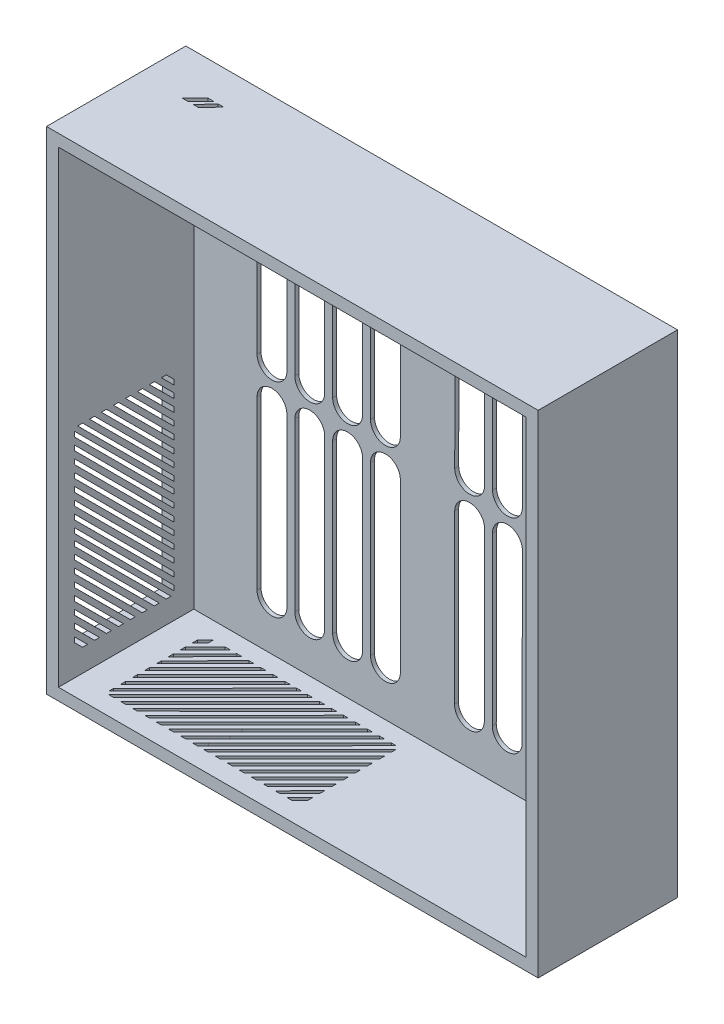
from build123d import *

# Parameters (mm, degrees)
ESBO_O1_W                = 247
ESBO_O1_H                = 247
RESSALTO_EXTRUS_O1_DEPTH = 70
ESBO_O2_W                = 235
ESBO_O2_H                = 235
CORTE_EXTRUS_O1_DEPTH    = 68
CORTE_EXTRUS_O2_DEPTH    = 338.361039757
CORTE_EXTRUS_O4_DEPTH    = 13
ESBO_O12_R               = 13.5
CORTE_EXTRUS_O7_DEPTH    = 10
CORTE_EXTRUS_O8_DEPTH    = 2


with BuildPart() as part:
    # Esboço1 → Ressalto-extrusão1 (new body)
    with BuildSketch(Plane.XY):
        with Locations((106.930425713, 113.333887043)):
            Rectangle(ESBO_O1_W, ESBO_O1_H)
    extrude(amount=RESSALTO_EXTRUS_O1_DEPTH)

    # Esboço2 → Corte-extrusão1 (cut)
    with BuildSketch(Plane.XY.offset(70)):
        with Locations((106.930425713, 113.333887043)):
            Rectangle(ESBO_O2_W, ESBO_O2_H)
    extrude(amount=-CORTE_EXTRUS_O1_DEPTH, mode=Mode.SUBTRACT)

    # Esboço6 → Corte-extrusão2 (cut, through all)
    with BuildSketch(Plane.XY.offset(2)):
        with BuildLine():
            Line((21.196532394, 206.667609314), (21.196532394, 122.653986802))
            ThreePointArc((21.196532394, 122.653986802), (28.696532394, 115.153986802), (36.196532394, 122.653986802))
            Line((36.196532394, 122.653986802), (36.196532394, 206.667609314))
            ThreePointArc((36.196532394, 206.667609314), (28.696532394, 214.167609314), (21.196532394, 206.667609314))
        make_face()
        with BuildLine():
            Line((40.196532394, 206.667609314), (40.196532394, 122.653986802))
            ThreePointArc((40.196532394, 122.653986802), (47.696532394, 115.153986802), (55.196532394, 122.653986802))
            Line((55.196532394, 122.653986802), (55.196532394, 206.667609314))
            ThreePointArc((55.196532394, 206.667609314), (47.696532394, 214.167609314), (40.196532394, 206.667609314))
        make_face()
        with BuildLine():
            Line((59.196532394, 206.667609314), (59.196532394, 122.653986802))
            ThreePointArc((59.196532394, 122.653986802), (66.696532394, 115.153986802), (74.196532394, 122.653986802))
            Line((74.196532394, 122.653986802), (74.196532394, 206.667609314))
            ThreePointArc((74.196532394, 206.667609314), (66.696532394, 214.167609314), (59.196532394, 206.667609314))
        make_face()
        with BuildLine():
            Line((78.196532394, 206.667609314), (78.196532394, 122.653986802))
            ThreePointArc((78.196532394, 122.653986802), (85.696532394, 115.153986802), (93.196532394, 122.653986802))
            Line((93.196532394, 122.653986802), (93.196532394, 206.667609314))
            ThreePointArc((93.196532394, 206.667609314), (85.696532394, 214.167609314), (78.196532394, 206.667609314))
        make_face()
        with BuildLine():
            Line((93.196532394, 104.013787284), (93.196532394, 20.000164773))
            ThreePointArc((93.196532394, 20.000164773), (85.696532394, 12.500164773), (78.196532394, 20.000164773))
            Line((78.196532394, 20.000164773), (78.196532394, 104.013787284))
            ThreePointArc((78.196532394, 104.013787284), (85.696532394, 111.513787284), (93.196532394, 104.013787284))
        make_face()
        with BuildLine():
            Line((74.196532394, 104.013787284), (74.196532394, 20.000164773))
            ThreePointArc((74.196532394, 20.000164773), (66.696532394, 12.500164773), (59.196532394, 20.000164773))
            Line((59.196532394, 20.000164773), (59.196532394, 104.013787284))
            ThreePointArc((59.196532394, 104.013787284), (66.696532394, 111.513787284), (74.196532394, 104.013787284))
        make_face()
        with BuildLine():
            Line((55.196532394, 104.013787284), (55.196532394, 20.000164773))
            ThreePointArc((55.196532394, 20.000164773), (47.696532394, 12.500164773), (40.196532394, 20.000164773))
            Line((40.196532394, 20.000164773), (40.196532394, 104.013787284))
            ThreePointArc((40.196532394, 104.013787284), (47.696532394, 111.513787284), (55.196532394, 104.013787284))
        make_face()
        with BuildLine():
            Line((36.196532394, 20.000164773), (36.196532394, 104.013787284))
            ThreePointArc((36.196532394, 104.013787284), (28.696532394, 111.513787284), (21.196532394, 104.013787284))
            Line((21.196532394, 104.013787284), (21.196532394, 20.000164773))
            ThreePointArc((21.196532394, 20.000164773), (28.696532394, 12.500164773), (36.196532394, 20.000164773))
        make_face()
        with BuildLine():
            Line((192.376128957, 19.883203927), (192.490935861, 103.896747995))
            ThreePointArc((192.490935861, 103.896747995), (185.001191818, 111.406989947), (177.490949866, 103.917245904))
            Line((177.490949866, 103.917245904), (177.376142963, 19.903701836))
            ThreePointArc((177.376142963, 19.903701836), (184.865887006, 12.393459884), (192.376128957, 19.883203927))
        make_face()
        with BuildLine():
            Line((173.376146697, 19.909167945), (173.490953601, 103.922712013))
            ThreePointArc((173.490953601, 103.922712013), (166.001209558, 111.432953964), (158.490967607, 103.943209921))
            Line((158.490967607, 103.943209921), (158.376160703, 19.929665853))
            ThreePointArc((158.376160703, 19.929665853), (165.865904746, 12.419423902), (173.376146697, 19.909167945))
        make_face()
        with BuildLine():
            Line((154.376164438, 19.935131962), (154.490971341, 103.94867603))
            ThreePointArc((154.490971341, 103.94867603), (147.001227299, 111.458917982), (139.490985347, 103.969173939))
            Line((139.490985347, 103.969173939), (139.376178443, 19.955629871))
            ThreePointArc((139.376178443, 19.955629871), (146.865922486, 12.445387919), (154.376164438, 19.935131962))
        make_face()
        with BuildLine():
            Line((135.376182178, 19.96109598), (135.490989082, 103.974640048))
            ThreePointArc((135.490989082, 103.974640048), (128.001245039, 111.484881999), (120.491003087, 103.995137956))
            Line((120.491003087, 103.995137956), (120.376196184, 19.981593889))
            ThreePointArc((120.376196184, 19.981593889), (127.865940226, 12.471351937), (135.376182178, 19.96109598))
        make_face()
        with BuildLine():
            Line((120.516475428, 122.63532007), (120.631282331, 206.648864138))
            ThreePointArc((120.631282331, 206.648864138), (128.141524283, 214.138608181), (135.631268326, 206.62836623))
            Line((135.631268326, 206.62836623), (135.516461422, 122.614822162))
            ThreePointArc((135.516461422, 122.614822162), (128.006219471, 115.125078119), (120.516475428, 122.63532007))
        make_face()
        with BuildLine():
            Line((139.516457687, 122.609356053), (139.631264591, 206.622900121))
            ThreePointArc((139.631264591, 206.622900121), (147.141506543, 214.112644164), (154.631250586, 206.602402212))
            Line((154.631250586, 206.602402212), (154.516443682, 122.588858144))
            ThreePointArc((154.516443682, 122.588858144), (147.00620173, 115.099114101), (139.516457687, 122.609356053))
        make_face()
        with BuildLine():
            Line((158.516439947, 122.583392035), (158.631246851, 206.596936103))
            ThreePointArc((158.631246851, 206.596936103), (166.141488802, 214.086680146), (173.631232845, 206.576438195))
            Line((173.631232845, 206.576438195), (173.516425942, 122.562894127))
            ThreePointArc((173.516425942, 122.562894127), (166.00618399, 115.073150084), (158.516439947, 122.583392035))
        make_face()
        with BuildLine():
            Line((177.631229111, 206.570972086), (177.516422207, 122.557428018))
            ThreePointArc((177.516422207, 122.557428018), (185.00616625, 115.047186066), (192.516408201, 122.536930109))
            Line((192.516408201, 122.536930109), (192.631215105, 206.550474177))
            ThreePointArc((192.631215105, 206.550474177), (185.141471062, 214.060716129), (177.631229111, 206.570972086))
        make_face()
    extrude(amount=-CORTE_EXTRUS_O2_DEPTH, mode=Mode.SUBTRACT)

    # Esboço8 → Corte-extrusão4 (cut)
    with BuildSketch(Plane.ZY.offset(16.569574287)):
        Polygon((11.895615494, 100.730742173), (15.857255805, 104.692382484), (18.357255805, 104.692382484), (11.895615494, 98.230742173), align=None)
        Polygon((11.852312146, 94.775580177), (21.757697368, 104.692382484), (24.357255805, 104.692382484), (11.853752083, 92.275580592), align=None)
        Polygon((11.861943842, 88.760864638), (27.790595707, 104.692382484), (30.357255805, 104.692382484), (11.86216873, 86.260864648), align=None)
        Polygon((11.864095793, 82.764940279), (33.794331519, 104.692382484), (36.357255805, 104.692382484), (11.863936555, 80.264940284), align=None)
        Polygon((11.865595216, 76.762704835), (39.812055782, 104.692382484), (42.357255805, 104.692382484), (11.864844318, 74.262704948), align=None)
        Polygon((11.93869954, 70.730933686), (45.857255805, 104.692382484), (48.400148337, 104.692382484), (11.93869954, 68.230933686), align=None)
        Polygon((11.895931269, 64.731057947), (51.903900936, 104.692382484), (54.407140012, 104.692382484), (11.895931269, 62.231057947), align=None)
        Polygon((11.871516708, 58.762580973), (57.857255805, 104.692382484), (60.357255805, 104.692382484), (11.870035565, 56.262581412), align=None)
        Polygon((61.911968804, 103.135826191), (61.90900652, 100.635827946), (15.924748126, 54.703279833), (11.895615494, 50.678702868), (11.895615494, 53.178702868), (13.424748564, 54.70602512), align=None)
        Polygon((61.904918431, 97.185714575), (61.901952309, 94.682477257), (24.451876506, 57.157799184), (11.936022772, 44.619982921), (11.938720282, 47.119981466), (21.95926615, 57.160488722), align=None)
        Polygon((61.897800665, 91.178727117), (61.894787557, 88.635836371), (30.390951819, 57.151390893), (11.929546709, 38.618096169), (11.932244219, 41.118094714), (27.852249054, 57.154130165), align=None)
        Polygon((61.89064036, 85.135838828), (61.887624517, 82.590640591), (36.431584875, 57.144873023), (11.923103094, 32.646280955), (11.925768402, 35.116435387), (33.893669953, 57.147611444), align=None)
        Polygon((61.883530878, 79.13584304), (61.880494034, 76.572920552), (42.429399239, 57.138401354), (11.916634848, 26.651638958), (11.919293089, 29.115244239), (39.899230142, 57.141131418), align=None)
        Polygon((61.876421396, 73.135847252), (61.873380126, 70.569188956), (48.421143565, 57.131936235), (11.910171604, 20.661632201), (11.912823927, 23.119752559), (45.898664535, 57.134658001), align=None)
        Polygon((61.869311915, 67.135851464), (61.866231663, 64.536294851), (54.440787346, 57.125441012), (11.903708704, 14.671944747), (11.906359107, 17.128285462), (51.926154398, 57.128154312), align=None)
        Polygon((61.862202433, 61.135855676), (61.859240149, 58.635857431), (60.34082007, 57.11907485), (11.897294937, 8.727792298), (11.896960539, 11.163182019), (57.833220959, 57.121780561), align=None)
        Polygon((13.452090361, 7.171318338), (15.887478303, 7.168356145), (61.895615494, 53.055000319), (61.895615494, 55.56260089), align=None)
        Polygon((19.39624627, 7.171318338), (21.852588415, 7.171318338), (61.895615494, 47.147930319), (61.895615494, 49.662564731), align=None)
        Polygon((25.385937211, 7.171318338), (27.844059, 7.171318338), (61.895615494, 41.120436947), (61.895615494, 43.642917446), align=None)
        Polygon((31.375947455, 7.171318338), (33.83955417, 7.171318338), (61.895615494, 35.120999062), (61.895615494, 37.651169632), align=None)
        Polygon((37.370592941, 7.171318338), (39.840748811, 7.171318338), (61.895615494, 29.115435377), (61.895615494, 31.653351776), align=None)
        Polygon((43.342411632, 7.171318338), (45.842411632, 7.171318338), (61.895615494, 23.074010961), (61.895615494, 25.612715204), align=None)
        Polygon((49.344301877, 7.171318338), (51.844301877, 7.171318338), (61.895615496, 17.181024627), (61.895615496, 19.673636434), align=None)
        Polygon((55.387191478, 7.171318338), (57.887191478, 7.171318338), (61.895615494, 11.163149517), (61.90600724, 13.663149517), align=None)
    extrude(amount=-CORTE_EXTRUS_O4_DEPTH, mode=Mode.SUBTRACT)

    # Esboço12 → Corte-extrusão7 (cut)
    with BuildSketch(Plane.XZ.offset(10.166112957)):
        with Locations(Location((200.485605127, 24.656721414, 0), (0, 0, 270))):
            Circle(ESBO_O12_R)
        Polygon((97.339878372, 60.59143644), (101.301518682, 56.629796129), (101.301518682, 54.129796129), (94.839878372, 60.59143644), align=None)
        Polygon((91.384716376, 60.634739789), (101.301518682, 50.729354567), (101.301518682, 48.129796129), (88.884716791, 60.633299852), align=None)
        Polygon((85.370000837, 60.625108093), (101.301518682, 44.696456227), (101.301518682, 42.129796129), (82.870000847, 60.624883205), align=None)
        Polygon((79.374076478, 60.622956142), (101.301518682, 38.692720416), (101.301518682, 36.129796129), (76.874076483, 60.62311538), align=None)
        Polygon((73.371841034, 60.621456718), (101.301518682, 32.674996153), (101.301518682, 30.129796129), (70.871841147, 60.622207616), align=None)
        Polygon((67.340069885, 60.548352395), (101.301518682, 26.629796129), (101.301518682, 24.086903598), (64.840069885, 60.548352395), align=None)
        Polygon((61.340194146, 60.591120666), (101.301518682, 20.583150998), (101.301518682, 18.079911922), (58.840194146, 60.591120666), align=None)
        Polygon((55.371717172, 60.615535227), (101.301518682, 14.629796129), (101.301518682, 12.129796129), (52.871717611, 60.617016369), align=None)
        Polygon((99.74496239, 10.57508313), (97.244964145, 10.578045414), (51.312416026, 56.562303815), (47.287839067, 60.59143644), (49.787839067, 60.59143644), (51.315161318, 59.06230337), align=None)
        Polygon((93.794850774, 10.582133504), (91.291613456, 10.585099626), (53.766935386, 48.035175425), (41.22911912, 60.551029163), (43.729117664, 60.548331653), (53.769624924, 50.527785781), align=None)
        Polygon((87.787863316, 10.58925127), (85.244972569, 10.592264378), (53.760527092, 42.096100116), (35.227232368, 60.557505225), (37.727230913, 60.554807716), (53.763266363, 44.634802881), align=None)
        Polygon((81.744975026, 10.596411575), (79.19977679, 10.599427417), (53.754009221, 36.05546706), (29.255417153, 60.563948841), (31.725571586, 60.561283533), (53.756747643, 38.593381982), align=None)
        Polygon((75.744979238, 10.603521057), (73.182056751, 10.606557901), (53.747537553, 30.057652696), (23.260775157, 60.570417087), (25.724380438, 60.567758845), (53.750267617, 32.587821792), align=None)
        Polygon((69.74498345, 10.610630538), (67.178325154, 10.613671809), (53.741072434, 24.06590837), (17.2707684, 60.576880331), (19.728888758, 60.574228008), (53.7437942, 26.5883874), align=None)
        Polygon((63.744987663, 10.61774002), (61.14543105, 10.620820272), (53.734577211, 18.046264588), (11.281080946, 60.583343231), (13.737421661, 60.580692828), (53.737290511, 20.560897537), align=None)
        Polygon((57.744991875, 10.624849501), (55.24499363, 10.627811785), (53.728211049, 12.146231864), (5.336928497, 60.589756998), (7.772318217, 60.590091396), (53.73091676, 14.653830975), align=None)
        Polygon((3.780454537, 59.034961574), (3.777492344, 56.599573632), (49.664136518, 10.59143644), (52.171737089, 10.59143644), align=None)
        Polygon((3.780454537, 53.090805665), (3.780454537, 50.634463519), (43.757066518, 10.59143644), (46.27170093, 10.59143644), align=None)
        Polygon((3.780454537, 47.101114724), (3.780454537, 44.642992935), (37.729573146, 10.59143644), (40.252053644, 10.59143644), align=None)
        Polygon((3.780454537, 41.11110448), (3.780454537, 38.647497765), (31.730135261, 10.59143644), (34.260305831, 10.59143644), align=None)
        Polygon((3.780454537, 35.116458994), (3.780454537, 32.646303124), (25.724571576, 10.59143644), (28.262487975, 10.59143644), align=None)
        Polygon((3.780454537, 29.144640303), (3.780454537, 26.644640303), (19.68314716, 10.59143644), (22.221851403, 10.59143644), align=None)
        Polygon((3.780454537, 23.142750057), (3.780454537, 20.642750057), (13.790160829, 10.591436435), (16.282772636, 10.591436435), align=None)
        Polygon((3.780454537, 17.099860457), (3.780454537, 14.599860457), (7.772285715, 10.59143644), (7.772285715, 13.09143644), align=None)
    extrude(amount=-CORTE_EXTRUS_O7_DEPTH, mode=Mode.SUBTRACT)

    # Esboço13 → Corte-extrusão8 (cut)
    with BuildSketch(Plane(origin=(0, 236.833887043, 0), x_dir=(1, 0, 0), z_dir=(0, 1, 0))):
        Polygon((5.268757587, -23.578601012), (11.753607331, -17.093751268), (14.503607331, -17.093751268), (8.018757587, -23.578601012), align=None)
        Polygon((10.802241344, -23.578601012), (16.69840733, -17.093751268), (19.44840733, -17.093751268), (13.552241344, -23.578601012), align=None)
    extrude(amount=-CORTE_EXTRUS_O8_DEPTH, mode=Mode.SUBTRACT)


solid = part.part
